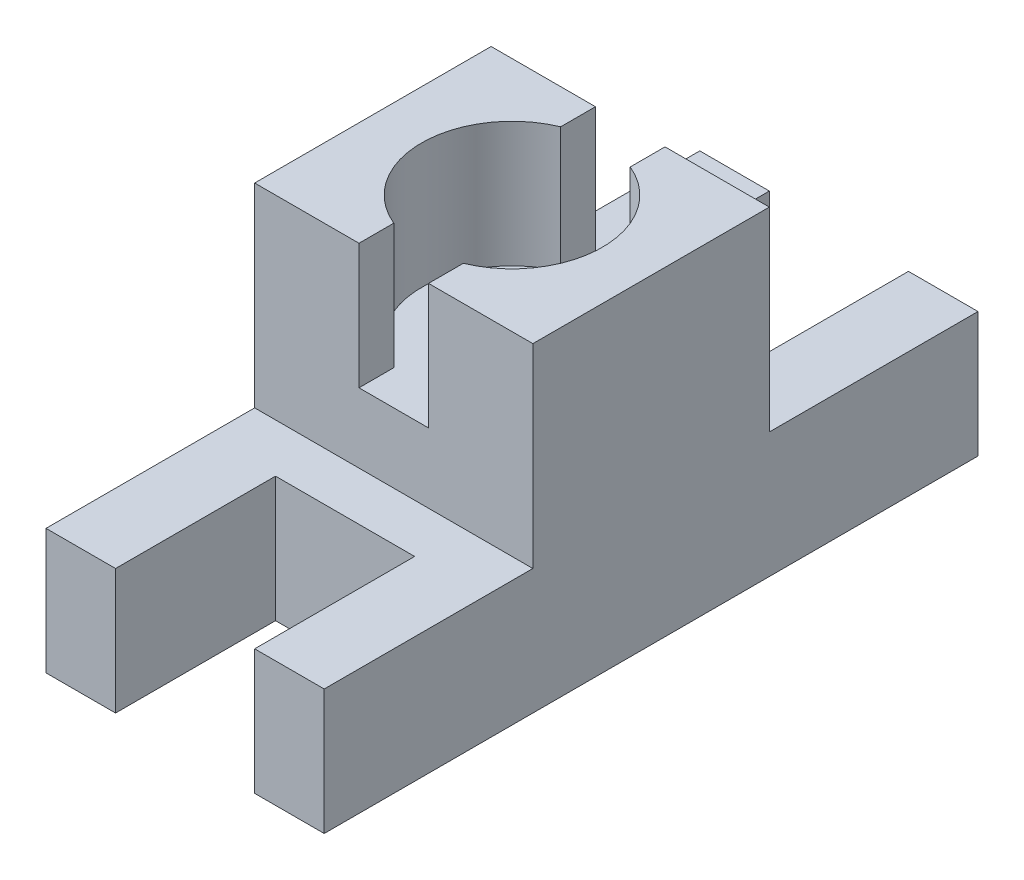
from build123d import *

# Parameters (mm, degrees)
SALIENTE_EXTRUIR1_DEPTH = 40
CROQUIS3_W              = 20
CROQUIS3_H              = 23
CORTAR_EXTRUIR1_DEPTH   = 68.771675499
CORTAR_EXTRUIR2_DEPTH   = 18


with BuildPart() as part:
    # Croquis2 → Saliente-Extruir1 (new body)
    with BuildSketch(Plane(origin=(0, 0, 0), x_dir=(0, 0, -1), z_dir=(1, 0, 0))):
        Polygon((17, 9), (47, 9), (47, -9), (-47, -9), (-47, 9), (-17, 9), (-17, 37), (17, 37), align=None)
    extrude(amount=-SALIENTE_EXTRUIR1_DEPTH)

    # Croquis3 → Cortar-Extruir1 (cut, through all)
    with BuildSketch(Plane(origin=(0, 9, 0), x_dir=(1, 0, 0), z_dir=(0, 1, 0))):
        with Locations((-20, 35.5)):
            Rectangle(CROQUIS3_W, CROQUIS3_H)
        with Locations((-20, -35.5)):
            Rectangle(CROQUIS3_W, CROQUIS3_H)
    extrude(amount=-CORTAR_EXTRUIR1_DEPTH, mode=Mode.SUBTRACT)

    # Croquis4 → Cortar-Extruir2 (cut)
    with BuildSketch(Plane(origin=(0, 37, 0), x_dir=(1, 0, 0), z_dir=(0, 1, 0))):
        with BuildLine():
            Line((-25, 17), (-15, 17))
            Line((-15, 17), (-15, 12))
            ThreePointArc((-15, 12), (-7, 0), (-15, -12))
            Line((-15, -12), (-15, -17))
            Line((-15, -17), (-25, -17))
            Line((-25, -17), (-25, -12))
            ThreePointArc((-25, -12), (-33, 0), (-25, 12))
            Line((-25, 12), (-25, 17))
        make_face()
    extrude(amount=-CORTAR_EXTRUIR2_DEPTH, mode=Mode.SUBTRACT)


solid = part.part
